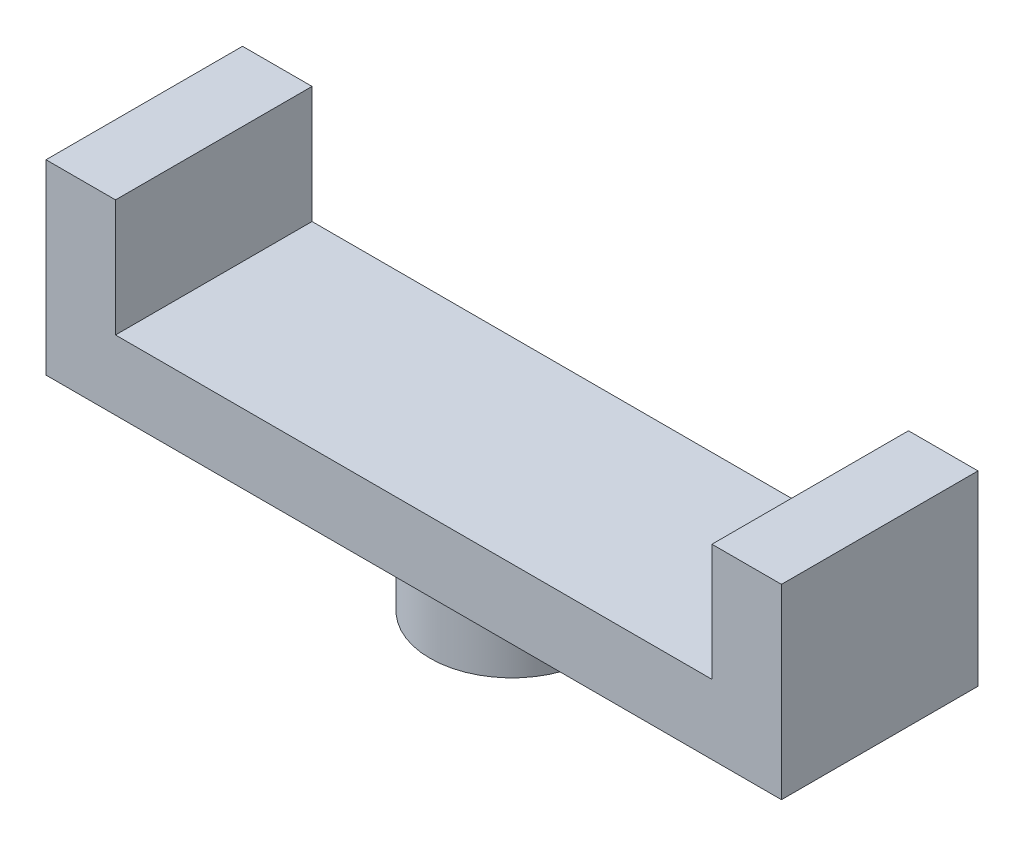
from build123d import *

# Parameters (mm, degrees)
SKETCH1_R           = 5.9
SKETCH1_R_2         = 2.3
BOSS_EXTRUDE1_DEPTH = 5
SKETCH2_W           = 42.9
SKETCH2_H           = 14.13586664
BOSS_EXTRUDE2_DEPTH = 5
SKETCH3_W           = 14.13586664
SKETCH3_H           = 13.416162411
BOSS_EXTRUDE3_DEPTH = 5


with BuildPart() as part:
    # Sketch1 → Boss-Extrude1 (new body)
    with BuildSketch(Plane(origin=(0, 0, 0), x_dir=(1, 0, 0), z_dir=(0, 1, 0))):
        with Locations(Location((0, 0, 0), (0, 0, 270))):
            Circle(SKETCH1_R)
        with Locations(Location((0, 0, 0), (0, 0, 270))):
            Circle(SKETCH1_R_2, mode=Mode.SUBTRACT)
    extrude(amount=BOSS_EXTRUDE1_DEPTH)

    # Sketch2 → Boss-Extrude2 (add)
    with BuildSketch(Plane(origin=(0, 5, 0), x_dir=(1, 0, 0), z_dir=(0, 1, 0))):
        Rectangle(SKETCH2_W, SKETCH2_H)
    extrude(amount=BOSS_EXTRUDE2_DEPTH)

    # Sketch3 → Boss-Extrude3 (add)
    with BuildSketch(Plane.ZY.offset(21.45)):
        with Locations((0, 11.708081206)):
            Rectangle(SKETCH3_W, SKETCH3_H)
    boss_extrude3 = extrude(amount=BOSS_EXTRUDE3_DEPTH)

    # Mirror1: Boss-Extrude3 across plane
    add(boss_extrude3.mirror(Plane(origin=(0, 0, 0), x_dir=(0, 0, 1), z_dir=(1, 0, 0))))


solid = part.part
